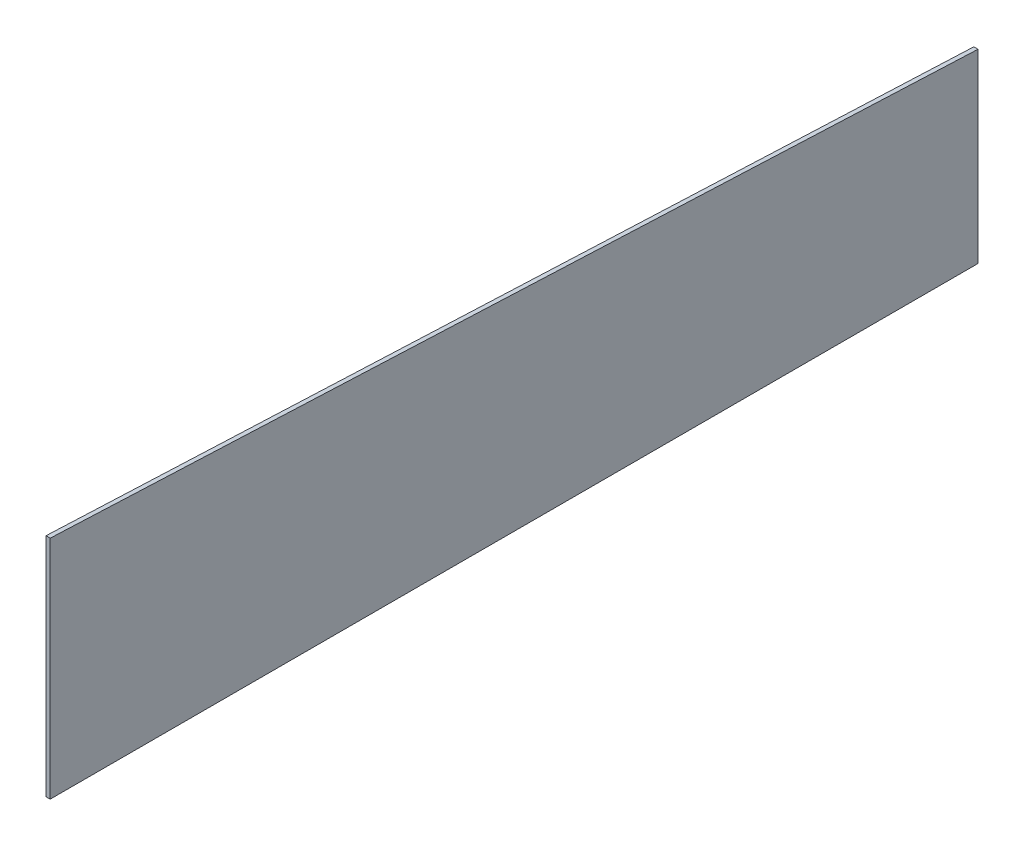
from build123d import *

# Parameters (mm, degrees)
BOSS_EXTRUDE1_DEPTH = 3.175


with BuildPart() as part:
    # Sketch1 → Boss-Extrude1 (new body)
    with BuildSketch(Plane(origin=(0, 0, 0), x_dir=(0, 0, -1), z_dir=(1, 0, 0))):
        Polygon((0, 0), (698.5, 0), (698.5, 139.7), (0, 170.197168622), (0, 139.7), align=None)
    extrude(amount=BOSS_EXTRUDE1_DEPTH)


solid = part.part
